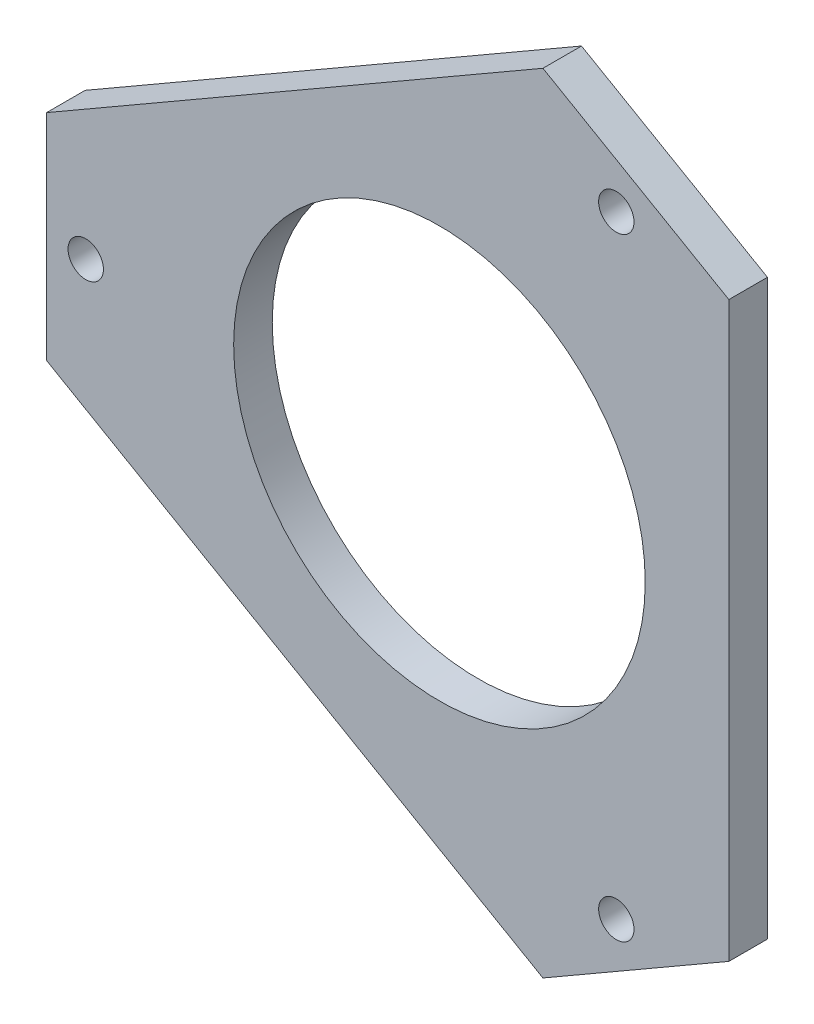
from build123d import *

# Parameters (mm, degrees)
ESBO_O1_R                = 32
RESSALTO_EXTRUS_O1_DEPTH = 6
FURO_COM_FOLGA_DE_M51_D  = 5.5


with BuildPart() as part:
    # Esboço1 → Ressalto-extrusão1 (new body)
    with BuildSketch(Plane.XY.offset(10)):
        Polygon((16.091018061, 61.251677836), (45, 44.561069332), (45, -44.561069332), (16.091018061, -61.251677836), (-61.091018061, -16.690608504), (-61.091018061, 16.690608504), align=None)
        Circle(ESBO_O1_R, mode=Mode.SUBTRACT)
    extrude(amount=RESSALTO_EXTRUS_O1_DEPTH)

    # Furo com folga de M51 (through all)
    with Locations(Plane(origin=(-55, 0, 16), x_dir=(1, 0, 0), z_dir=(0, 0, 1))):
        with Locations((0, 0), (82.5, 47.631397208), (82.5, -47.631397208)):
            Hole(FURO_COM_FOLGA_DE_M51_D / 2)


solid = part.part
